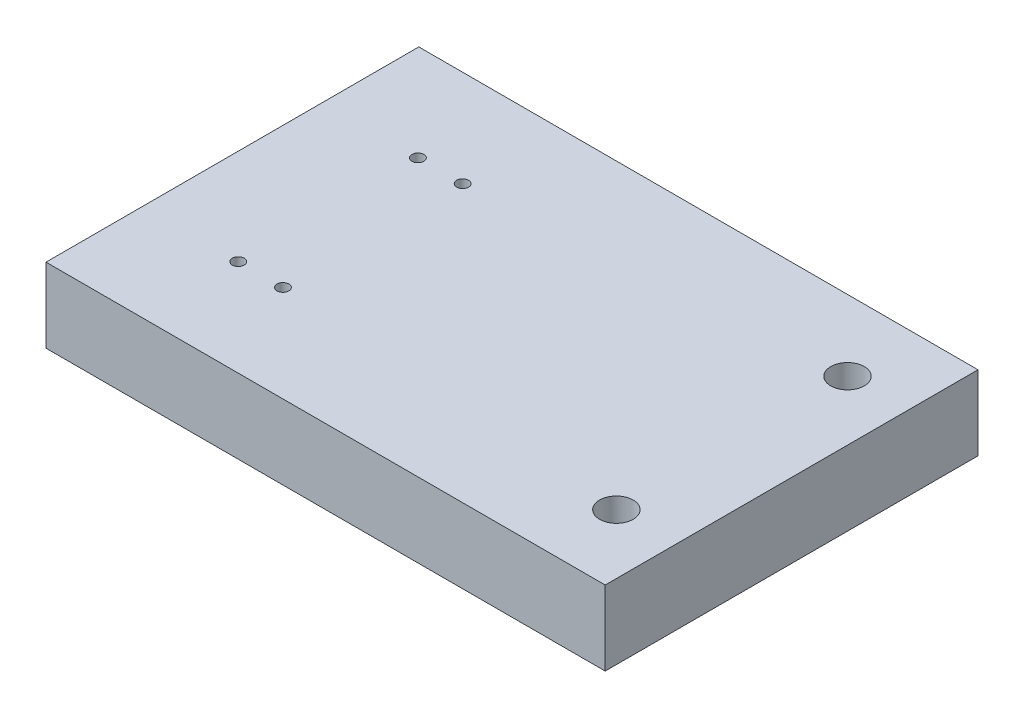
from build123d import *

# Parameters (mm, degrees)
SKETCH2_W             = 75
SKETCH2_H             = 50
PLATE_TOPVIEW_DEPTH   = 10
CHANNEL_DEPTH         = 1
CONNETION_SKETCH_R    = 0.8
CONNETION_SKETCH_R_2  = 2.25
CONNECTING_PORT_DEPTH = 12


with BuildPart() as part:
    # Sketch2 → Plate_topview (new body)
    with BuildSketch(Plane(origin=(0, 0, 0), x_dir=(1, 0, 0), z_dir=(0, 1, 0))):
        Rectangle(SKETCH2_W, SKETCH2_H)
    extrude(amount=PLATE_TOPVIEW_DEPTH)

    # channel_sketch → Channel (cut, symmetric)
    with BuildSketch(Plane(origin=(0, 5, 0), x_dir=(1, 0, 0), z_dir=(0, 1, 0))):
        with BuildLine():
            Line((3.927905037, 0.5), (2.478027018, 2.312347524))
            ThreePointArc((2.478027018, 2.312347524), (2.304186978, 2.450651618), (2.087592613, 2.5))
            Line((2.087592613, 2.5), (-2.43178254, 2.5))
            ThreePointArc((-2.43178254, 2.5), (-2.648376905, 2.450651618), (-2.822216944, 2.312347524))
            Line((-2.822216944, 2.312347524), (-4.272094963, 0.5))
            Line((-4.272094963, 0.5), (-7.964988182, 0.5))
            Line((-7.964988182, 0.5), (-11.943057517, 4.478069335))
            ThreePointArc((-11.943057517, 4.478069335), (-12.024163354, 4.532262522), (-12.119834212, 4.551292639))
            Line((-12.119834212, 4.551292639), (-18.172094963, 4.551292639))
            Line((-18.172094963, 4.551292639), (-18.172094963, 11.492275645))
            ThreePointArc((-18.172094963, 11.492275645), (-18.672094963, 12.801292639), (-19.172094963, 11.492275645))
            Line((-19.172094963, 11.492275645), (-19.172094963, 4.551292639))
            Line((-19.172094963, 4.551292639), (-23.922094963, 4.551292639))
            ThreePointArc((-23.922094963, 4.551292639), (-24.098871659, 4.624515944), (-24.172094963, 4.801292639))
            Line((-24.172094963, 4.801292639), (-24.172094963, 11.492275645))
            ThreePointArc((-24.172094963, 11.492275645), (-24.672094963, 12.801292639), (-25.172094963, 11.492275645))
            Line((-25.172094963, 11.492275645), (-25.172094963, 4.551292639))
            ThreePointArc((-25.172094963, 4.551292639), (-24.879201745, 3.844185858), (-24.172094963, 3.551292639))
            Line((-24.172094963, 3.551292639), (-18.172094963, 3.551292639))
            Line((-18.172094963, 3.551292639), (-12.430494384, 3.551292639))
            Line((-12.430494384, 3.551292639), (-8.879201745, 0))
            Line((-8.879201745, 0), (-12.430494384, -3.551292639))
            Line((-12.430494384, -3.551292639), (-18.172094963, -3.551292639))
            Line((-18.172094963, -3.551292639), (-24.172094963, -3.551292639))
            ThreePointArc((-24.172094963, -3.551292639), (-24.879201745, -3.844185858), (-25.172094963, -4.551292639))
            Line((-25.172094963, -4.551292639), (-25.172094963, -11.492275645))
            ThreePointArc((-25.172094963, -11.492275645), (-24.672094963, -12.801292639), (-24.172094963, -11.492275645))
            Line((-24.172094963, -11.492275645), (-24.172094963, -4.801292639))
            ThreePointArc((-24.172094963, -4.801292639), (-24.098871659, -4.624515944), (-23.922094963, -4.551292639))
            Line((-23.922094963, -4.551292639), (-19.172094963, -4.551292639))
            Line((-19.172094963, -4.551292639), (-19.172094963, -11.492275645))
            ThreePointArc((-19.172094963, -11.492275645), (-18.672094963, -12.801292639), (-18.172094963, -11.492275645))
            Line((-18.172094963, -11.492275645), (-18.172094963, -4.551292639))
            Line((-18.172094963, -4.551292639), (-12.119834212, -4.551292639))
            ThreePointArc((-12.119834212, -4.551292639), (-12.024163354, -4.532262522), (-11.943057517, -4.478069335))
            Line((-11.943057517, -4.478069335), (-7.964988182, -0.5))
            Line((-7.964988182, -0.5), (-4.272094963, -0.5))
            Line((-4.272094963, -0.5), (-2.822216944, -2.312347524))
            ThreePointArc((-2.822216944, -2.312347524), (-2.648376905, -2.450651618), (-2.43178254, -2.5))
            Line((-2.43178254, -2.5), (2.087592613, -2.5))
            ThreePointArc((2.087592613, -2.5), (2.304186978, -2.450651618), (2.478027018, -2.312347524))
            Line((2.478027018, -2.312347524), (3.927905037, -0.5))
            Line((3.927905037, -0.5), (5.077905037, -0.5))
            ThreePointArc((5.077905037, -0.5), (5.254681732, -0.573223305), (5.327905037, -0.75))
            Line((5.327905037, -0.75), (5.327905037, -14.5))
            ThreePointArc((5.327905037, -14.5), (5.620798255, -15.207106781), (6.327905037, -15.5))
            Line((6.327905037, -15.5), (8.327905037, -15.5))
            ThreePointArc((8.327905037, -15.5), (9.035011818, -15.207106781), (9.327905037, -14.5))
            Line((9.327905037, -14.5), (9.327905037, 14.234055176))
            ThreePointArc((9.327905037, 14.234055176), (9.401128341, 14.410831872), (9.577905037, 14.484055176))
            Line((9.577905037, 14.484055176), (11.077905037, 14.484055176))
            ThreePointArc((11.077905037, 14.484055176), (11.254681732, 14.410831872), (11.327905037, 14.234055176))
            Line((11.327905037, 14.234055176), (11.327905037, -14.5))
            ThreePointArc((11.327905037, -14.5), (11.620798255, -15.207106781), (12.327905037, -15.5))
            Line((12.327905037, -15.5), (14.327905037, -15.5))
            ThreePointArc((14.327905037, -15.5), (15.035011818, -15.207106781), (15.327905037, -14.5))
            Line((15.327905037, -14.5), (15.327905037, 14.234055176))
            ThreePointArc((15.327905037, 14.234055176), (15.401128341, 14.410831872), (15.577905037, 14.484055176))
            Line((15.577905037, 14.484055176), (17.077905037, 14.484055176))
            ThreePointArc((17.077905037, 14.484055176), (17.254681732, 14.410831872), (17.327905037, 14.234055176))
            Line((17.327905037, 14.234055176), (17.327905037, -14.5))
            ThreePointArc((17.327905037, -14.5), (17.620798255, -15.207106781), (18.327905037, -15.5))
            Line((18.327905037, -15.5), (20.327905037, -15.5))
            ThreePointArc((20.327905037, -15.5), (21.035011818, -15.207106781), (21.327905037, -14.5))
            Line((21.327905037, -14.5), (21.327905037, -0.75))
            ThreePointArc((21.327905037, -0.75), (21.401128341, -0.573223305), (21.577905037, -0.5))
            Line((21.577905037, -0.5), (24.5, -0.5))
            Line((24.5, -0.5), (24.5, -7))
            ThreePointArc((24.5, -7), (24.646446609, -7.353553391), (25, -7.5))
            Line((25, -7.5), (28.85, -7.5))
            Line((28.85, -7.5), (28.85, -13.55577779))
            ThreePointArc((28.85, -13.55577779), (29.5, -17.55), (30.15, -13.55577779))
            Line((30.15, -13.55577779), (30.15, -7.5))
            Line((30.15, -7.5), (34, -7.5))
            ThreePointArc((34, -7.5), (34.353553391, -7.353553391), (34.5, -7))
            Line((34.5, -7), (34.5, 7))
            ThreePointArc((34.5, 7), (34.353553391, 7.353553391), (34, 7.5))
            Line((34, 7.5), (30.15, 7.5))
            Line((30.15, 7.5), (30.15, 13.55577779))
            ThreePointArc((30.15, 13.55577779), (29.5, 17.55), (28.85, 13.55577779))
            Line((28.85, 13.55577779), (28.85, 7.5))
            Line((28.85, 7.5), (25, 7.5))
            ThreePointArc((25, 7.5), (24.646446609, 7.353553391), (24.5, 7))
            Line((24.5, 7), (24.5, 0.5))
            Line((24.5, 0.5), (21.327905037, 0.5))
            ThreePointArc((21.327905037, 0.5), (20.620798255, 0.207106781), (20.327905037, -0.5))
            Line((20.327905037, -0.5), (20.327905037, -14.25))
            ThreePointArc((20.327905037, -14.25), (20.254681732, -14.426776695), (20.077905037, -14.5))
            Line((20.077905037, -14.5), (18.577905037, -14.5))
            ThreePointArc((18.577905037, -14.5), (18.401128341, -14.426776695), (18.327905037, -14.25))
            Line((18.327905037, -14.25), (18.327905037, 14.484055176))
            ThreePointArc((18.327905037, 14.484055176), (18.035011818, 15.191161957), (17.327905037, 15.484055176))
            Line((17.327905037, 15.484055176), (15.327905037, 15.484055176))
            ThreePointArc((15.327905037, 15.484055176), (14.620798255, 15.191161957), (14.327905037, 14.484055176))
            Line((14.327905037, 14.484055176), (14.327905037, -14.25))
            ThreePointArc((14.327905037, -14.25), (14.254681732, -14.426776695), (14.077905037, -14.5))
            Line((14.077905037, -14.5), (12.577905037, -14.5))
            ThreePointArc((12.577905037, -14.5), (12.401128341, -14.426776695), (12.327905037, -14.25))
            Line((12.327905037, -14.25), (12.327905037, 14.484055176))
            ThreePointArc((12.327905037, 14.484055176), (12.035011818, 15.191161957), (11.327905037, 15.484055176))
            Line((11.327905037, 15.484055176), (9.327905037, 15.484055176))
            ThreePointArc((9.327905037, 15.484055176), (8.620798255, 15.191161957), (8.327905037, 14.484055176))
            Line((8.327905037, 14.484055176), (8.327905037, -14.25))
            ThreePointArc((8.327905037, -14.25), (8.254681732, -14.426776695), (8.077905037, -14.5))
            Line((8.077905037, -14.5), (6.577905037, -14.5))
            ThreePointArc((6.577905037, -14.5), (6.401128341, -14.426776695), (6.327905037, -14.25))
            Line((6.327905037, -14.25), (6.327905037, -0.5))
            ThreePointArc((6.327905037, -0.5), (6.035011818, 0.207106781), (5.327905037, 0.5))
            Line((5.327905037, 0.5), (3.927905037, 0.5))
        make_face()
    extrude(amount=CHANNEL_DEPTH, both=True, mode=Mode.SUBTRACT)

    # connetion_sketch → Connecting_port (cut)
    with BuildSketch(Plane(origin=(0, 5, 0), x_dir=(1, 0, 0), z_dir=(0, 1, 0))):
        with Locations(Location((-24.672094963, 12.051292639, 0), (0, 0, 231.317812547))):
            Circle(CONNETION_SKETCH_R)
        with Locations(Location((-18.672094963, 12.051292639, 0), (0, 0, 231.317812547))):
            Circle(CONNETION_SKETCH_R)
        with Locations(Location((-18.672094963, -12.051292639, 0), (0, 0, 51.317812547))):
            Circle(CONNETION_SKETCH_R)
        with Locations(Location((-24.672094963, -12.051292639, 0), (0, 0, 51.317812547))):
            Circle(CONNETION_SKETCH_R)
        with Locations(Location((29.5, 15.5, 0), (0, 0, 286.791447115))):
            Circle(CONNETION_SKETCH_R_2)
        with Locations(Location((29.5, -15.5, 0), (0, 0, 106.791447115))):
            Circle(CONNETION_SKETCH_R_2)
    extrude(amount=CONNECTING_PORT_DEPTH, mode=Mode.SUBTRACT)


solid = part.part
